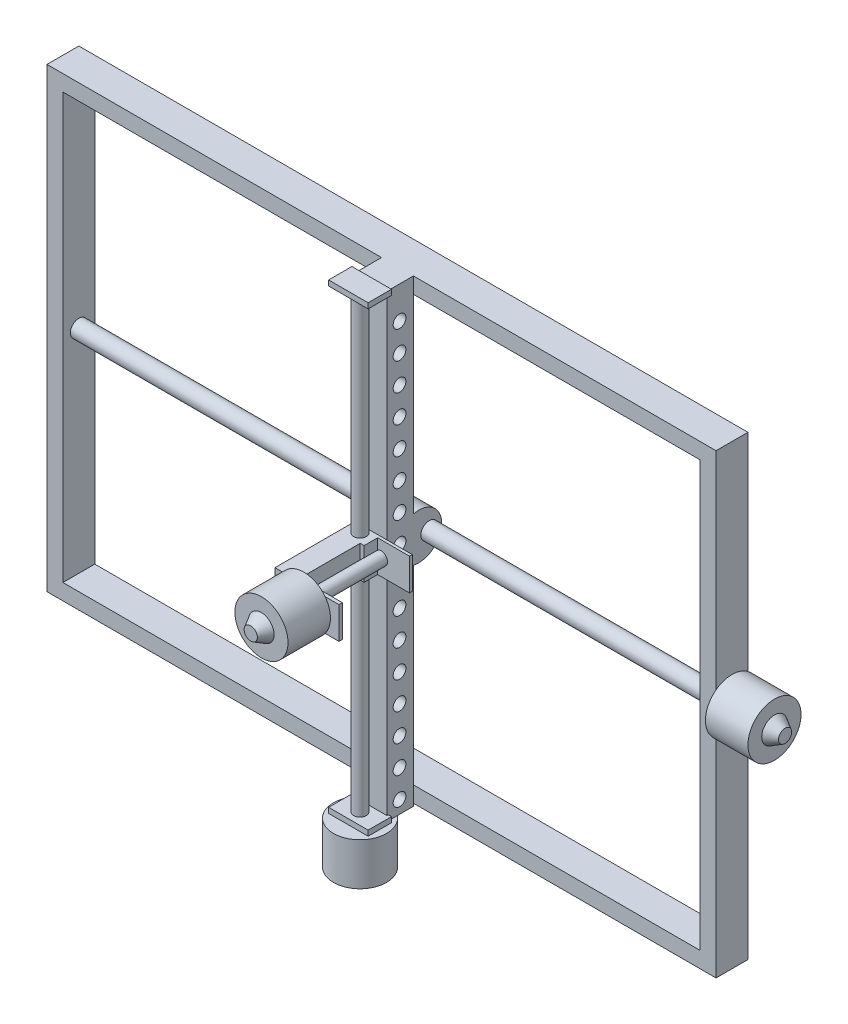
from build123d import *

# Parameters (mm, degrees)
CROQUIS1_W               = 630
CROQUIS1_H               = 430
CROQUIS1_W_2             = 600
CROQUIS1_H_2             = 400
SALIENTE_EXTRUIR1_DEPTH  = 30
CROQUIS2_R               = 25
SALIENTE_EXTRUIR2_DEPTH  = 40
CROQUIS3_R               = 8
SALIENTE_EXTRUIR3_DEPTH  = 655
CROQUIS4_W               = 24.992302178
CROQUIS4_H               = 432.519106968
SALIENTE_EXTRUIR4_DEPTH  = 30
CROQUIS5_R               = 21.487484315
SALIENTE_EXTRUIR5_DEPTH  = 30
CROQUIS6_W               = 37.188725544
CROQUIS6_H               = 21.959056988
SALIENTE_EXTRUIR6_DEPTH  = 5
CROQUIS7_R               = 25
SALIENTE_EXTRUIR7_DEPTH  = 40
CROQUIS8_R               = 6
SALIENTE_EXTRUIR9_DEPTH  = 470.038213936
CROQUIS9_W               = 23.953368217
CROQUIS9_H               = 15.340921218
SALIENTE_EXTRUIR10_DEPTH = 15
CROQUIS10_W              = 20.266041209
CROQUIS10_H              = 30
SALIENTE_EXTRUIR11_DEPTH = 60
CROQUIS11_R              = 25
SALIENTE_EXTRUIR12_DEPTH = 40
CROQUIS12_W              = 2.6069841
CROQUIS12_H              = 30
SALIENTE_EXTRUIR13_DEPTH = 30
SALIENTE_EXTRUIR14_REACH = 477.248
CROQUIS13_R              = 6
CROQUIS14_W              = 3.214241105
CROQUIS14_H              = 30
SALIENTE_EXTRUIR15_DEPTH = 40
CROQUIS16_R              = 12
SALIENTE_EXTRUIR16_DEPTH = 10
SALIENTE_EXTRUIR16_TAPER = 30
CROQUIS17_R              = 12
SALIENTE_EXTRUIR17_DEPTH = 10
SALIENTE_EXTRUIR17_TAPER = 30
CROQUIS18_R              = 12
SALIENTE_EXTRUIR18_DEPTH = 10
SALIENTE_EXTRUIR18_TAPER = 30
CROQUIS19_R              = 6
CORTAR_EXTRUIR1_DEPTH    = 70


with BuildPart() as part:
    # Croquis1 → Saliente-Extruir1 (new body)
    with BuildSketch(Plane.XY):
        Rectangle(CROQUIS1_W, CROQUIS1_H)
        Rectangle(CROQUIS1_W_2, CROQUIS1_H_2, mode=Mode.SUBTRACT)
    extrude(amount=SALIENTE_EXTRUIR1_DEPTH)

    # Croquis2 → Saliente-Extruir2 (add)
    with BuildSketch(Plane(origin=(315, 0, 0), x_dir=(0, 0, -1), z_dir=(1, 0, 0))):
        with Locations(Location((-15, 0, 0), (0, 0, 233.130102354))):
            Circle(CROQUIS2_R)
    extrude(amount=SALIENTE_EXTRUIR2_DEPTH)

    # Croquis3 → Saliente-Extruir3 (add)
    with BuildSketch(Plane(origin=(355, 0, 0), x_dir=(0, 0, -1), z_dir=(1, 0, 0))):
        with Locations(Location((-15, 0, 0), (0, 0, 180))):
            Circle(CROQUIS3_R)
    extrude(amount=-SALIENTE_EXTRUIR3_DEPTH)

    # Croquis4 → Saliente-Extruir4 (add)
    with BuildSketch(Plane(origin=(0, 0, 0), x_dir=(0, 0, -1), z_dir=(1, 0, 0))):
        with Locations((-42.496151089, -1.259553484)):
            Rectangle(CROQUIS4_W, CROQUIS4_H)
    extrude(amount=SALIENTE_EXTRUIR4_DEPTH)

    # Croquis5 → Saliente-Extruir5 (add)
    with BuildSketch(Plane(origin=(30, 0, 0), x_dir=(0, 0, -1), z_dir=(1, 0, 0))):
        with Locations((-24.875396623, 0)):
            Circle(CROQUIS5_R)
    extrude(amount=-SALIENTE_EXTRUIR5_DEPTH)

    # Croquis6 → Saliente-Extruir6 (add)
    with BuildSketch(Plane.XZ.offset(217.519106968)):
        with Locations((14.477087252, 64.71265509)):
            Rectangle(CROQUIS6_W, CROQUIS6_H)
    saliente_extruir6 = extrude(amount=-SALIENTE_EXTRUIR6_DEPTH)

    # Simetría1: Saliente-Extruir6 across plane
    add(saliente_extruir6.mirror(Plane.ZX))

    # Croquis7 → Saliente-Extruir7 (add)
    with BuildSketch(Plane.XZ.offset(217.519106968)):
        with Locations(Location((14.477087252, 64.71265509, 0), (0, 0, 308.383093816))):
            Circle(CROQUIS7_R)
    extrude(amount=SALIENTE_EXTRUIR7_DEPTH)

    # Croquis8 → Saliente-Extruir9 (add)
    with BuildSketch(Plane.XZ.offset(257.519106968)):
        with Locations(Location((14.477087252, 64.71265509, 0), (0, 0, 270))):
            Circle(CROQUIS8_R)
    extrude(amount=-SALIENTE_EXTRUIR9_DEPTH)

    # Croquis9 → Saliente-Extruir10 (add, symmetric)
    with BuildSketch(Plane(origin=(0, 0, 0), x_dir=(1, 0, 0), z_dir=(0, 1, 0))):
        with Locations((14.702855752, -65.412295985)):
            Rectangle(CROQUIS9_W, CROQUIS9_H)
    extrude(amount=SALIENTE_EXTRUIR10_DEPTH, both=True)

    # Croquis10 → Saliente-Extruir11 (add)
    with BuildSketch(Plane.XY.offset(73.082756594)):
        with Locations((12.859192248, 0)):
            Rectangle(CROQUIS10_W, CROQUIS10_H)
    extrude(amount=SALIENTE_EXTRUIR11_DEPTH)

    # Croquis11 → Saliente-Extruir12 (add)
    with BuildSketch(Plane.XY.offset(133.082756594)):
        with Locations(Location((30, 0, 0), (0, 0, 216.869897646))):
            Circle(CROQUIS11_R)
    extrude(amount=SALIENTE_EXTRUIR12_DEPTH)

    # Croquis12 → Saliente-Extruir13 (add)
    with BuildSketch(Plane(origin=(26.67953986, 0, 0), x_dir=(0, 0, -1), z_dir=(1, 0, 0))):
        with Locations((-59.045327426, 0)):
            Rectangle(CROQUIS12_W, CROQUIS12_H)
    extrude(amount=SALIENTE_EXTRUIR13_DEPTH)

    # Saliente-Extruir14: up to this face of the body (flat: up to its plane)
    saliente_extruir14_end = Plane(part.part.faces().sort_by_distance((41.67953986, 0, 60.348819476))[0])
    # Croquis13 → Saliente-Extruir14 (add, up to the picked face)
    with BuildSketch(Plane.XY.offset(173.082756594), mode=Mode.PRIVATE) as saliente_extruir14_sk1:
        with Locations((30, 0)):
            Circle(CROQUIS13_R)
    saliente_extruir14_tool1 = split(extrude(saliente_extruir14_sk1.sketch, amount=-SALIENTE_EXTRUIR14_REACH, mode=Mode.PRIVATE), bisect_by=saliente_extruir14_end, keep=Keep.BOTH, mode=Mode.PRIVATE)
    add(saliente_extruir14_tool1.solids().sort_by(Axis((30, 0, 173.082757), (0, 0, -1)))[0])

    # Croquis14 → Saliente-Extruir15 (add)
    with BuildSketch(Plane(origin=(22.992212852, 0, 0), x_dir=(0, 0, -1), z_dir=(1, 0, 0))):
        with Locations((-131.475636042, 0)):
            Rectangle(CROQUIS14_W, CROQUIS14_H)
    extrude(amount=SALIENTE_EXTRUIR15_DEPTH)

    # Croquis16 → Saliente-Extruir16 (add)
    with BuildSketch(Plane(origin=(355, 0, 0), x_dir=(0, 0, -1), z_dir=(1, 0, 0))):
        with Locations((-15, 0)):
            Circle(CROQUIS16_R)
    extrude(amount=SALIENTE_EXTRUIR16_DEPTH, taper=SALIENTE_EXTRUIR16_TAPER)

    # Croquis17 → Saliente-Extruir17 (add)
    with BuildSketch(Plane.XZ.offset(257.519106968)):
        with Locations((14.477087252, 64.71265509)):
            Circle(CROQUIS17_R)
    extrude(amount=SALIENTE_EXTRUIR17_DEPTH, taper=SALIENTE_EXTRUIR17_TAPER)

    # Croquis18 → Saliente-Extruir18 (add)
    with BuildSketch(Plane.XY.offset(173.082756594)):
        with Locations((29.930352353, 0)):
            Circle(CROQUIS18_R)
    extrude(amount=SALIENTE_EXTRUIR18_DEPTH, taper=SALIENTE_EXTRUIR18_TAPER)

    # Croquis19 → Cortar-Extruir1 (cut)
    with BuildSketch(Plane(origin=(30, 0, 0), x_dir=(0, 0, -1), z_dir=(1, 0, 0))):
        with Locations((-43.031639772, -205.41246119)):
            Circle(CROQUIS19_R)
        with Locations((-43.031639772, -179.41246119)):
            Circle(CROQUIS19_R)
        with Locations((-43.031639772, -153.41246119)):
            Circle(CROQUIS19_R)
        with Locations((-43.031639772, -127.41246119)):
            Circle(CROQUIS19_R)
        with Locations((-43.031639772, -101.41246119)):
            Circle(CROQUIS19_R)
        with Locations((-43.031639772, -75.41246119)):
            Circle(CROQUIS19_R)
        with Locations((-43.031639772, -49.41246119)):
            Circle(CROQUIS19_R)
        with Locations((-43.031639772, -23.41246119)):
            Circle(CROQUIS19_R)
        with Locations((-43.031639772, 2.58753881)):
            Circle(CROQUIS19_R)
        with Locations((-43.031639772, 28.58753881)):
            Circle(CROQUIS19_R)
        with Locations((-43.031639772, 54.58753881)):
            Circle(CROQUIS19_R)
        with Locations((-43.031639772, 80.58753881)):
            Circle(CROQUIS19_R)
        with Locations((-43.031639772, 106.58753881)):
            Circle(CROQUIS19_R)
        with Locations((-43.031639772, 132.58753881)):
            Circle(CROQUIS19_R)
        with Locations((-43.031639772, 158.58753881)):
            Circle(CROQUIS19_R)
        with Locations((-43.031639772, 184.58753881)):
            Circle(CROQUIS19_R)
    extrude(amount=-CORTAR_EXTRUIR1_DEPTH, mode=Mode.SUBTRACT)


solid = part.part
